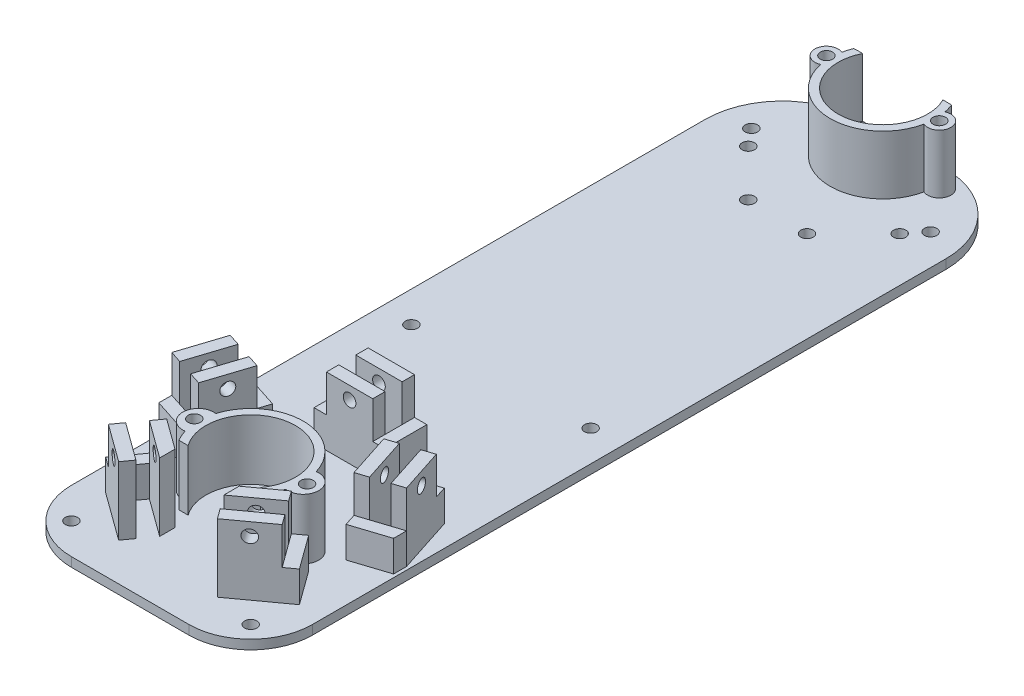
from build123d import *

# Parameters (mm, degrees)
IZIM1_W                      = 78
IZIM1_H                      = 78
Y_KSEKLIK_EKSTR_ZYON1_DEPTH  = 3
Y_KSEKLIK_EKSTR_ZYON5_DEPTH  = 19.5
IZIM10_R                     = 2
KES_EKSTR_ZYON3_DEPTH        = 26.5
IZIM18_W                     = 78
IZIM18_H                     = 78
Y_KSEKLIK_EKSTR_ZYON8_DEPTH  = 3
DIK_W                        = 15
DIK_H                        = 4
Y_KSEKLIK_EKSTR_ZYON12_DEPTH = 22
YANDESTEK_W                  = 4
YANDESTEK_H                  = 13.5
Y_KSEKLIK_EKSTR_ZYON13_DEPTH = 10
IZIM23_R                     = 2.05
KES_EKSTR_ZYON4_DEPTH        = 14
IZIM24_R                     = 2.05
KES_EKSTR_ZYON5_DEPTH        = 14
IZIM25_R                     = 2.05
KES_EKSTR_ZYON6_DEPTH        = 14
IZIM26_R                     = 2.05
KES_EKSTR_ZYON7_DEPTH        = 14
IZIM27_R                     = 2.05
KES_EKSTR_ZYON8_DEPTH        = 14
IZIM28_W                     = 78
IZIM28_H                     = 94
Y_KSEKLIK_EKSTR_ZYON15_DEPTH = 3
IZIM29_R                     = 2
KES_EKSTR_ZYON9_DEPTH        = 3
IZIM30_R                     = 2
Y_KSEKLIK_EKSTR_ZYON16_DEPTH = 19
IZIM31_R                     = 7.5
KES_EKSTR_ZYON10_DEPTH       = 19
KES_EKSTR_ZYON11_START       = -19
IZIM32_R                     = 2
KES_EKSTR_ZYON11_DEPTH       = 19
RADYUS1_R                    = 25
RADYUS2_R                    = 20


with BuildPart() as part:
    # Çizim1 → Yükseklik-Ekstrüzyon1 (new body)
    with BuildSketch(Plane(origin=(0, 0, 0), x_dir=(1, 0, 0), z_dir=(0, 1, 0))):
        with Locations((0, -9)):
            Rectangle(IZIM1_W, IZIM1_H)
    extrude(amount=Y_KSEKLIK_EKSTR_ZYON1_DEPTH)

    # Çizim9 → Yükseklik-Ekstrüzyon5 (add)
    with BuildSketch(Plane(origin=(0, 3, 0), x_dir=(1, 0, 0), z_dir=(0, 1, 0))):
        with BuildLine():
            Line((-14.722431864, -17.5), (-11.747340124, -17.5))
            ThreePointArc((-11.747340124, -17.5), (0, 5.5), (11.747340124, -17.5))
            Line((11.747340124, -17.5), (14.722431864, -17.5))
            ThreePointArc((14.722431864, -17.5), (15.595161026, -15.766901254), (16.264705882, -13.945638741))
            ThreePointArc((16.264705882, -13.945638741), (22, -9), (16.264705882, -4.054361259))
            ThreePointArc((16.264705882, -4.054361259), (0, 8), (-16.264705882, -4.054361259))
            ThreePointArc((-16.264705882, -4.054361259), (-22, -9), (-16.264705882, -13.945638741))
            ThreePointArc((-16.264705882, -13.945638741), (-15.595161026, -15.766901254), (-14.722431864, -17.5))
        make_face()
    extrude(amount=Y_KSEKLIK_EKSTR_ZYON5_DEPTH)

    # Çizim10 → Kes-Ekstrüzyon3 (cut)
    with BuildSketch(Plane(origin=(0, 22.5, 0), x_dir=(1, 0, 0), z_dir=(0, 1, 0))):
        with Locations(Location((-18.25, -9, 0), (0, 0, 270))):
            Circle(IZIM10_R)
        with Locations(Location((18.25, -9, 0), (0, 0, 270))):
            Circle(IZIM10_R)
    extrude(amount=-KES_EKSTR_ZYON3_DEPTH, mode=Mode.SUBTRACT)

    # Çizim18 → Yükseklik-Ekstrüzyon8 (add)
    with BuildSketch(Plane(origin=(0, 0, 0), x_dir=(1, 0, 0), z_dir=(0, 1, 0))):
        with Locations((0, 69)):
            Rectangle(IZIM18_W, IZIM18_H)
    extrude(amount=Y_KSEKLIK_EKSTR_ZYON8_DEPTH)

    # dik → Yükseklik-Ekstrüzyon12 (add)
    with BuildSketch(Plane(origin=(0, 3, 0), x_dir=(1, 0, 0), z_dir=(0, 1, 0))):
        with Locations((0, 34.5)):
            Rectangle(DIK_W, DIK_H)
        with Locations((0, 25)):
            Rectangle(DIK_W, DIK_H)
        Polygon((33.346991903, 17.721061161), (37.982246819, 3.455213417), (34.178020754, 2.219145439), (29.542765838, 16.484993184), align=None)
        Polygon((24.311954998, 14.785399715), (20.507728933, 13.549331737), (25.142983849, -0.716516007), (28.947209914, 0.51955197), align=None)
        Polygon((28.109574419, -26.929747897), (15.974319503, -35.746526681), (13.623178494, -32.510458704), (25.75843341, -23.693679919), align=None)
        Polygon((22.525614522, -19.24408645), (20.174473513, -16.008018473), (10.390359606, -23.116593325), (10.390359606, -28.060865235), align=None)
        Polygon((-15.974319503, -35.746526681), (-28.109574419, -26.929747897), (-25.75843341, -23.693679919), (-13.623178494, -32.510458704), align=None)
        Polygon((-10.390359606, -23.116593325), (-20.174473513, -16.008018473), (-22.525614522, -19.24408645), (-10.390359606, -28.060865235), align=None)
        Polygon((-37.982246819, 3.455213417), (-33.346991903, 17.721061161), (-29.542765838, 16.484993184), (-34.178020754, 2.219145439), align=None)
        Polygon((-28.947209914, 0.51955197), (-25.142983849, -0.716516007), (-20.507728933, 13.549331737), (-24.311954998, 14.785399715), align=None)
    extrude(amount=Y_KSEKLIK_EKSTR_ZYON12_DEPTH)

    # yandestek → Yükseklik-Ekstrüzyon13 (add)
    with BuildSketch(Plane(origin=(0, 3, 0), x_dir=(1, 0, 0), z_dir=(0, 1, 0))):
        Polygon((-37.982246819, 3.455213417), (-25.142983849, -0.716516007), (-26.379051826, -4.520742072), (-37.982246819, -0.75063548), align=None)
        Polygon((-20.174473513, -16.008018473), (-28.109574419, -26.929747897), (-31.345642396, -24.578606888), (-23.41054149, -13.656877464), align=None)
        Polygon((-20.507728933, 13.549331737), (-33.346991903, 17.721061161), (-32.110923926, 21.525287226), (-19.271660956, 17.353557802), align=None)
        with Locations((-9.5, 29.75)):
            Rectangle(YANDESTEK_W, YANDESTEK_H)
        with Locations((9.5, 29.75)):
            Rectangle(YANDESTEK_W, YANDESTEK_H)
        Polygon((32.110923926, 21.525287226), (33.346991903, 17.721061161), (20.507728933, 13.549331737), (19.271660956, 17.353557802), align=None)
        Polygon((37.982246819, 3.455213417), (37.982246819, -0.75063548), (26.379051826, -4.520742072), (25.142983849, -0.716516007), align=None)
        Polygon((31.345642396, -24.578606888), (28.109574419, -26.929747897), (20.174473513, -16.008018473), (23.41054149, -13.656877464), align=None)
    extrude(amount=Y_KSEKLIK_EKSTR_ZYON13_DEPTH)

    # Çizim23 → Kes-Ekstrüzyon4 (cut)
    with BuildSketch(Plane(origin=(-22.517475219, 0, 30.992645786), x_dir=(0.8090169943749423, 0, 0.5877852522924801), z_dir=(-0.5877852522924801, 0, 0.8090169943749423))):
        with Locations((0.587785252, 20.9)):
            Circle(IZIM23_R)
    extrude(amount=-KES_EKSTR_ZYON4_DEPTH, mode=Mode.SUBTRACT)

    # Çizim24 → Kes-Ekstrüzyon5 (cut)
    with BuildSketch(Plane(origin=(22.517475219, 0, 30.992645786), x_dir=(0.8090169943749507, 0, -0.5877852522924687), z_dir=(0.5877852522924687, 0, 0.8090169943749507))):
        with Locations((-0.587785252, 20.9)):
            Circle(IZIM24_R)
    extrude(amount=-KES_EKSTR_ZYON5_DEPTH, mode=Mode.SUBTRACT)

    # Çizim25 → Kes-Ekstrüzyon6 (cut)
    with BuildSketch(Plane(origin=(35.370726735, 0, -11.492645786), x_dir=(-0.30901699437494434, 0, -0.9510565162951546), z_dir=(0.9510565162951545, 0, -0.3090169943749443))):
        with Locations((-0.951056516, 20.9)):
            Circle(IZIM25_R)
    extrude(amount=-KES_EKSTR_ZYON6_DEPTH, mode=Mode.SUBTRACT)

    # Çizim26 → Kes-Ekstrüzyon7 (cut)
    with BuildSketch(Plane(origin=(0, 0, -36.5), x_dir=(-1, 0, 0), z_dir=(0, 0, -1))):
        with Locations((0, 20.9)):
            Circle(IZIM26_R)
    extrude(amount=-KES_EKSTR_ZYON7_DEPTH, mode=Mode.SUBTRACT)

    # Çizim27 → Kes-Ekstrüzyon8 (cut)
    with BuildSketch(Plane(origin=(-35.370726735, 0, -11.492645786), x_dir=(-0.30901699437494806, 0, 0.9510565162951534), z_dir=(-0.9510565162951534, 0, -0.30901699437494806))):
        with Locations((0.951056516, 20.9)):
            Circle(IZIM27_R)
    extrude(amount=-KES_EKSTR_ZYON8_DEPTH, mode=Mode.SUBTRACT)

    # Çizim28 → Yükseklik-Ekstrüzyon15 (add)
    with BuildSketch(Plane(origin=(0, 3, 0), x_dir=(1, 0, 0), z_dir=(0, 1, 0))):
        with Locations((0, 155)):
            Rectangle(IZIM28_W, IZIM28_H)
    extrude(amount=-Y_KSEKLIK_EKSTR_ZYON15_DEPTH)

    # Çizim29 → Kes-Ekstrüzyon9 (cut)
    with BuildSketch(Plane(origin=(0, 3, 0), x_dir=(1, 0, 0), z_dir=(0, 1, 0))):
        with Locations(Location((-9.5, 161.5, 0), (0, 0, 270))):
            Circle(IZIM29_R)
        with Locations(Location((9.5, 161.5, 0), (0, 0, 270))):
            Circle(IZIM29_R)
        with Locations(Location((-24.5, 176.5, 0), (0, 0, 270))):
            Circle(IZIM29_R)
        with Locations(Location((24.5, 176.5, 0), (0, 0, 270))):
            Circle(IZIM29_R)
    extrude(amount=-KES_EKSTR_ZYON9_DEPTH, mode=Mode.SUBTRACT)

    # Çizim30 → Yükseklik-Ekstrüzyon16 (add)
    with BuildSketch(Plane(origin=(0, 3, 0), x_dir=(1, 0, 0), z_dir=(0, 1, 0))):
        with BuildLine():
            Line((-15.782902141, 202), (-12.986435231, 202))
            ThreePointArc((-12.986435231, 202), (0, 181.05), (12.986435231, 202))
            Line((12.986435231, 202), (15.782902141, 202))
            ThreePointArc((15.782902141, 202), (16.314196986, 200.504742849), (16.704178082, 198.966567663))
            ThreePointArc((16.704178082, 198.966567663), (22, 195.55), (16.704178082, 192.133432337))
            ThreePointArc((16.704178082, 192.133432337), (0, 178.5), (-16.704178082, 192.133432337))
            ThreePointArc((-16.704178082, 192.133432337), (-22, 195.55), (-16.704178082, 198.966567663))
            ThreePointArc((-16.704178082, 198.966567663), (-16.314196986, 200.504742849), (-15.782902141, 202))
        make_face()
        with Locations(Location((-18.25, 195.55, 0), (0, 0, 270))):
            Circle(IZIM30_R, mode=Mode.SUBTRACT)
        with Locations(Location((18.25, 195.55, 0), (0, 0, 270))):
            Circle(IZIM30_R, mode=Mode.SUBTRACT)
    extrude(amount=Y_KSEKLIK_EKSTR_ZYON16_DEPTH)

    # Çizim31 → Kes-Ekstrüzyon10 (cut)
    with BuildSketch(Plane(origin=(0, 3, 0), x_dir=(1, 0, 0), z_dir=(0, 1, 0))):
        with Locations(Location((0, -9, 0), (0, 0, 270))):
            Circle(IZIM31_R)
        with Locations((0, 195.55)):
            Circle(IZIM31_R)
    extrude(amount=-KES_EKSTR_ZYON10_DEPTH, mode=Mode.SUBTRACT)

    # Çizim32 → Kes-Ekstrüzyon11 (cut)
    with BuildSketch(Plane(origin=(0, 3, 0), x_dir=(1, 0, 0), z_dir=(0, 1, 0)).offset(KES_EKSTR_ZYON11_START)):
        with Locations(Location((-29, 182, 0), (0, 0, 270))):
            Circle(IZIM32_R)
        with Locations(Location((29, 182, 0), (0, 0, 270))):
            Circle(IZIM32_R)
        with Locations(Location((-18.25, 195.55, 0), (0, 0, 90))):
            Circle(IZIM32_R)
        with Locations(Location((18.25, 195.55, 0), (0, 0, 90))):
            Circle(IZIM32_R)
        with Locations(Location((-29, -38, 0), (0, 0, 270))):
            Circle(IZIM32_R)
        with Locations(Location((29, -38, 0), (0, 0, 270))):
            Circle(IZIM32_R)
        with Locations(Location((-29, 72, 0), (0, 0, 270))):
            Circle(IZIM32_R)
        with Locations(Location((29, 72, 0), (0, 0, 270))):
            Circle(IZIM32_R)
    extrude(amount=KES_EKSTR_ZYON11_DEPTH, mode=Mode.SUBTRACT)

    # Radyus1
    radyus1_edges = [part.edges().sort_by_distance(p)[0] for p in [
        (-39, 1.5, -202),
        (39, 1.5, -202),
    ]]
    fillet(radyus1_edges, radius=RADYUS1_R)

    # Radyus2
    radyus2_edges = [part.edges().sort_by_distance(p)[0] for p in [
        (39, 1.5, 48),
        (-39, 1.5, 48),
    ]]
    fillet(radyus2_edges, radius=RADYUS2_R)


solid = part.part
